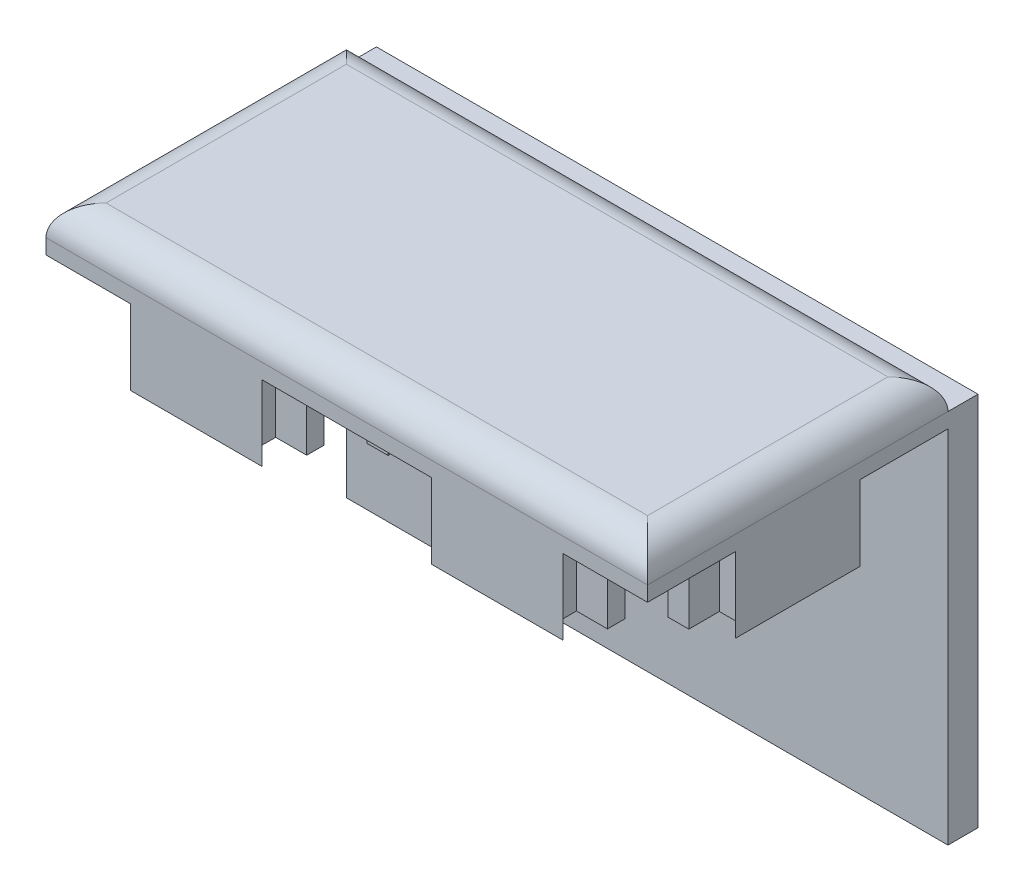
from build123d import *

# Parameters (mm, degrees)
CROQUIS2_R                = 1.779687177
SALIENTE_EXTRUIR1_DEPTH   = 5
SALIENTE_EXTRUIR1_2_DEPTH = 5
SALIENTE_EXTRUIR1_3_DEPTH = 5
SALIENTE_EXTRUIR1_4_DEPTH = 5
SALIENTE_EXTRUIR1_5_DEPTH = 5
SALIENTE_EXTRUIR1_6_DEPTH = 5
SALIENTE_EXTRUIR1_7_DEPTH = 5
SALIENTE_EXTRUIR1_8_DEPTH = 5
SALIENTE_EXTRUIR1_9_DEPTH = 5
CROQUIS3_W                = 40.052022685
CROQUIS3_H                = 20
SALIENTE_EXTRUIR2_DEPTH   = 3
REDONDEO1_R               = 2
CROQUIS4_W                = 40.052022685
CROQUIS4_H                = 25
SALIENTE_EXTRUIR3_DEPTH   = 3
CHAFL_N1_SIZE             = 1


with BuildPart() as part:
    # Croquis2 → Saliente-Extruir1 (new body)
    with BuildSketch(Plane(origin=(0, 0, 0), x_dir=(1, 0, 0), z_dir=(0, 1, 0))):
        with Locations(Location((-10.039017014, 0, 0), (0, 0, 90))):
            Circle(CROQUIS2_R)
    extrude(amount=SALIENTE_EXTRUIR1_DEPTH)



with BuildPart() as body_2:
    # Croquis2 → Saliente-Extruir1 2 (new body)
    with BuildSketch(Plane(origin=(0, 0, 0), x_dir=(1, 0, 0), z_dir=(0, 1, 0))):
        with Locations(Location((9.986994329, 0, 0), (0, 0, 270))):
            Circle(CROQUIS2_R)
    extrude(amount=SALIENTE_EXTRUIR1_2_DEPTH)


with BuildPart() as body_3:
    # Croquis2 → Saliente-Extruir1 3 (new body)
    with BuildSketch(Plane(origin=(0, 0, 0), x_dir=(1, 0, 0), z_dir=(0, 1, 0))):
        Polygon((5.614984779, 10), (14.359003879, 10), (13.134466077, 8.775462198), (13.134466077, 7.868577354), (15.198808852, 7.868577354), (15.198808852, 6.711119422), (12.681851378, 4.194161948), (7.292137279, 4.194161948), (4.775179805, 6.711119422), (4.775179805, 7.868577354), (6.839522581, 7.868577354), (6.839522581, 8.775462198), align=None)
    extrude(amount=SALIENTE_EXTRUIR1_3_DEPTH)


with BuildPart() as body_4:
    # Croquis2 → Saliente-Extruir1 4 (new body)
    with BuildSketch(Plane(origin=(0, 0, 0), x_dir=(1, 0, 0), z_dir=(0, 1, 0))):
        Polygon((20, 4.155027818), (20, -4.155027818), (18.985761672, -3.14078949), (17.919495795, -3.14078949), (17.919495795, -5.172992947), (16.531532714, -5.172992947), (14.175115642, -2.816575874), (14.175115642, 2.816575874), (16.531532714, 5.172992947), (17.919495795, 5.172992947), (17.919495795, 3.14078949), (18.985761672, 3.14078949), align=None)
    extrude(amount=SALIENTE_EXTRUIR1_4_DEPTH)


with BuildPart() as body_5:
    # Croquis2 → Saliente-Extruir1 5 (new body)
    with BuildSketch(Plane(origin=(0, 0, 0), x_dir=(1, 0, 0), z_dir=(0, 1, 0))):
        Polygon((-0.026011343, 4.155027818), (-1.040249671, 3.14078949), (-2.106515548, 3.14078949), (-2.106515548, 5.172992947), (-3.494478629, 5.172992947), (-5.850895701, 2.816575874), (-5.850895701, -2.816575874), (-3.494478629, -5.172992947), (-2.106515548, -5.172992947), (-2.106515548, -3.14078949), (-1.040249671, -3.14078949), (-0.026011343, -4.155027818), (0.988226986, -3.14078949), (2.054492862, -3.14078949), (2.054492862, -5.172992947), (3.442455943, -5.172992947), (5.798873016, -2.816575874), (5.798873016, 2.816575874), (3.442455943, 5.172992947), (2.054492862, 5.172992947), (2.054492862, 3.14078949), (0.988226986, 3.14078949), align=None)
    extrude(amount=SALIENTE_EXTRUIR1_5_DEPTH)


with BuildPart() as body_6:
    # Croquis2 → Saliente-Extruir1 6 (new body)
    with BuildSketch(Plane(origin=(0, 0, 0), x_dir=(1, 0, 0), z_dir=(0, 1, 0))):
        Polygon((4.775179805, -6.711119422), (7.292137279, -4.194161948), (12.681851378, -4.194161948), (15.198808852, -6.711119422), (15.198808852, -7.868577354), (13.134466077, -7.868577354), (13.134466077, -8.775462198), (14.359003879, -10), (5.614984779, -10), (6.839522581, -8.775462198), (6.839522581, -7.868577354), (4.775179805, -7.868577354), align=None)
    extrude(amount=SALIENTE_EXTRUIR1_6_DEPTH)


with BuildPart() as body_7:
    # Croquis2 → Saliente-Extruir1 7 (new body)
    with BuildSketch(Plane(origin=(0, 0, 0), x_dir=(1, 0, 0), z_dir=(0, 1, 0))):
        Polygon((-12.733874064, -4.194161948), (-7.344159964, -4.194161948), (-4.82720249, -6.711119422), (-4.82720249, -7.868577354), (-6.891545266, -7.868577354), (-6.891545266, -8.775462198), (-5.667007464, -10), (-14.411026564, -10), (-13.186488762, -8.775462198), (-13.186488762, -7.868577354), (-15.250831538, -7.868577354), (-15.250831538, -6.711119422), align=None)
    extrude(amount=SALIENTE_EXTRUIR1_7_DEPTH)


with BuildPart() as body_8:
    # Croquis2 → Saliente-Extruir1 8 (new body)
    with BuildSketch(Plane(origin=(0, 0, 0), x_dir=(1, 0, 0), z_dir=(0, 1, 0))):
        Polygon((-16.583555399, -5.172992947), (-14.227138327, -2.816575874), (-14.227138327, 2.816575874), (-16.583555399, 5.172992947), (-17.97151848, 5.172992947), (-17.97151848, 3.14078949), (-19.037784357, 3.14078949), (-20.052022685, 4.155027818), (-20.052022685, -4.155027818), (-19.037784357, -3.14078949), (-17.97151848, -3.14078949), (-17.97151848, -5.172992947), align=None)
    extrude(amount=SALIENTE_EXTRUIR1_8_DEPTH)


with BuildPart() as body_9:
    # Croquis2 → Saliente-Extruir1 9 (new body)
    with BuildSketch(Plane(origin=(0, 0, 0), x_dir=(1, 0, 0), z_dir=(0, 1, 0))):
        Polygon((-5.667007464, 10), (-6.891545266, 8.775462198), (-6.891545266, 7.868577354), (-4.82720249, 7.868577354), (-4.82720249, 6.711119422), (-7.344159964, 4.194161948), (-12.733874064, 4.194161948), (-15.250831538, 6.711119422), (-15.250831538, 7.868577354), (-13.186488762, 7.868577354), (-13.186488762, 8.775462198), (-14.411026564, 10), align=None)
    extrude(amount=SALIENTE_EXTRUIR1_9_DEPTH)


with BuildPart() as part_1:
    add(part.part)

    add(body_2.part)  # Saliente-Extruir2 merges body 2

    add(body_3.part)  # Saliente-Extruir2 merges body 3

    add(body_4.part)  # Saliente-Extruir2 merges body 4

    add(body_5.part)  # Saliente-Extruir2 merges body 5

    add(body_6.part)  # Saliente-Extruir2 merges body 6

    add(body_7.part)  # Saliente-Extruir2 merges body 7

    add(body_8.part)  # Saliente-Extruir2 merges body 8

    add(body_9.part)  # Saliente-Extruir2 merges body 9
    # Croquis3 → Saliente-Extruir2 (add)
    with BuildSketch(Plane(origin=(0, 5, 0), x_dir=(1, 0, 0), z_dir=(0, 1, 0))):
        with Locations((-0.026011343, 0)):
            Rectangle(CROQUIS3_W, CROQUIS3_H)
    extrude(amount=SALIENTE_EXTRUIR2_DEPTH)

    # Redondeo1
    redondeo1_edges = [part_1.edges().sort_by_distance(p)[0] for p in [
        (-20.052022685, 8, 0),
        (-0.026011343, 8, 10),
        (20, 8, 0),
        (-0.026011343, 8, -10),
    ]]
    fillet(redondeo1_edges, radius=REDONDEO1_R)

    # Croquis4 → Saliente-Extruir3 (add)
    with BuildSketch(Plane(origin=(0, 0, -10), x_dir=(-1, 0, 0), z_dir=(0, 0, -1))):
        with Locations((0.026011343, -6.5)):
            Rectangle(CROQUIS4_W, CROQUIS4_H)
    extrude(amount=SALIENTE_EXTRUIR3_DEPTH)

    # Chaflán1
    chafl_n1_edges = [part_1.edges().sort_by_distance(p)[0] for p in [
        (20, -6.5, -13),
        (-0.026011343, -19, -13),
        (-20.052022685, -6.5, -13),
        (-0.026011343, 6, -13),
    ]]
    chamfer(chafl_n1_edges, length=CHAFL_N1_SIZE)


solid = part_1.part
